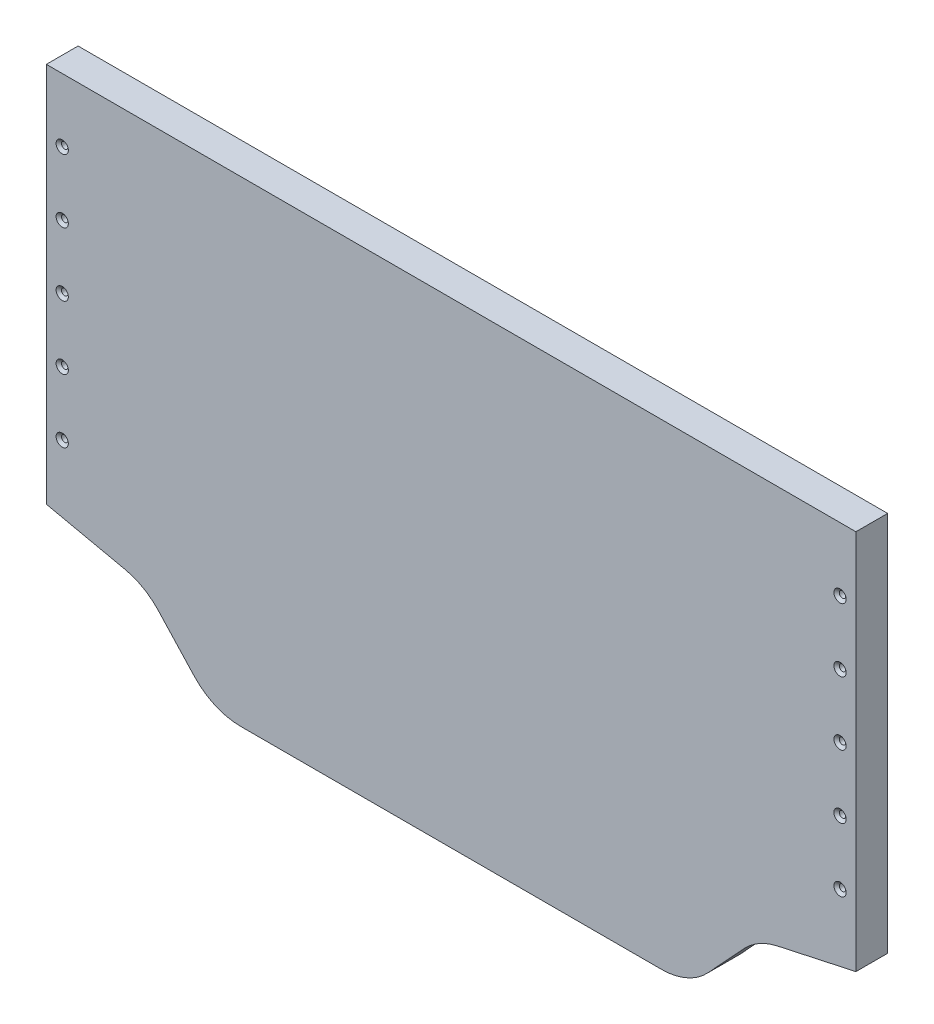
from build123d import *

# Parameters (mm, degrees)
BOSS_EXTRUDE1_DEPTH                        = 25.4
FILLET1_R                                  = 50.8
CSK_FOR_10_FLAT_HEAD_MACHINE_SCREW_2_COUNT = 2
CSK_FOR_10_FLAT_HEAD_MACHINE_SCREW_2_PITCH = 50.8
CSK_FOR_10_FLAT_HEAD_MACHINE_SCREW_3_COUNT = 2
CSK_FOR_10_FLAT_HEAD_MACHINE_SCREW_3_PITCH = 101.6
CSK_FOR_10_FLAT_HEAD_MACHINE_SCREW_4_COUNT = 2
CSK_FOR_10_FLAT_HEAD_MACHINE_SCREW_4_PITCH = 152.4
CSK_FOR_10_FLAT_HEAD_MACHINE_SCREW_5_COUNT = 2
CSK_FOR_10_FLAT_HEAD_MACHINE_SCREW_5_PITCH = 203.2


with BuildPart() as part:
    # Sketch1 → Boss-Extrude1 (new body)
    with BuildSketch(Plane.XY):
        Polygon((-245.162116144, 59.122546749), (-190.5, 0), (190.5, 0), (245.162116144, 59.122546749), (323.85, 76.2), (323.85, 381), (-323.85, 381), (-323.85, 76.2), align=None)
    extrude(amount=BOSS_EXTRUDE1_DEPTH)

    # Fillet1
    fillet1_edges = [part.edges().sort_by_distance(p)[0] for p in [
        (245.162116144, 59.122546749, 12.7),
        (190.5, 0, 12.7),
        (-190.5, 0, 12.7),
        (-245.162116144, 59.122546749, 12.7),
    ]]
    fillet(fillet1_edges, radius=FILLET1_R)

    # Sketch4 → CSK for #10 Flat Head Machine Screw (100)1 (revolve, cut)
    with BuildSketch(Plane(origin=(311.15, 330.2, 25.4), x_dir=(0, -1, 0), z_dir=(1, 0, 0))):
        Polygon((0, 0), (0, 52.333816902), (2.5527, 50.8), (2.5527, 1.960808018), (4.8895, 0), align=None)
    csk_for_10_flat_head_machine_screw_100 = revolve(axis=Axis((311.15, 330.2, 31.75), (0, 0, -1)), mode=Mode.SUBTRACT)

    # CSK for _10 Flat Head Machine Screw  2: CSK for #10 Flat Head Machine Screw (100)1 ×2
    with Locations(*[(0, -i * CSK_FOR_10_FLAT_HEAD_MACHINE_SCREW_2_PITCH, 0) for i in range(1, CSK_FOR_10_FLAT_HEAD_MACHINE_SCREW_2_COUNT)]):
        add(csk_for_10_flat_head_machine_screw_100, mode=Mode.SUBTRACT)

    # CSK for _10 Flat Head Machine Screw  3: CSK for #10 Flat Head Machine Screw (100)1 ×2
    with Locations(*[(0, -i * CSK_FOR_10_FLAT_HEAD_MACHINE_SCREW_3_PITCH, 0) for i in range(1, CSK_FOR_10_FLAT_HEAD_MACHINE_SCREW_3_COUNT)]):
        add(csk_for_10_flat_head_machine_screw_100, mode=Mode.SUBTRACT)

    # CSK for _10 Flat Head Machine Screw  4: CSK for #10 Flat Head Machine Screw (100)1 ×2
    with Locations(*[(0, -i * CSK_FOR_10_FLAT_HEAD_MACHINE_SCREW_4_PITCH, 0) for i in range(1, CSK_FOR_10_FLAT_HEAD_MACHINE_SCREW_4_COUNT)]):
        add(csk_for_10_flat_head_machine_screw_100, mode=Mode.SUBTRACT)

    # CSK for _10 Flat Head Machine Screw  5: CSK for #10 Flat Head Machine Screw (100)1 ×2
    with Locations(*[(0, -i * CSK_FOR_10_FLAT_HEAD_MACHINE_SCREW_5_PITCH, 0) for i in range(1, CSK_FOR_10_FLAT_HEAD_MACHINE_SCREW_5_COUNT)]):
        add(csk_for_10_flat_head_machine_screw_100, mode=Mode.SUBTRACT)

    # Mirror1: CSK for #10 Flat Head Machine Screw (100)1 across plane
    add(csk_for_10_flat_head_machine_screw_100.mirror(Plane(origin=(0, 0, 0), x_dir=(0, 0, 1), z_dir=(1, 0, 0))), mode=Mode.SUBTRACT)

    # Mirror1 copy 1 sketch → Mirror1 copy 1 (revolve, cut)
    with BuildSketch(Plane(origin=(-311.15, 279.4, 25.4), x_dir=(0, -1, 0), z_dir=(-1, 0, 0))):
        Polygon((0, 0), (0, -52.333816902), (2.5527, -50.8), (2.5527, -1.960808018), (4.8895, 0), align=None)
    revolve(axis=Axis((-311.15, 279.4, 31.75), (0, 0, 1)), mode=Mode.SUBTRACT)

    # Mirror1 copy 2 sketch → Mirror1 copy 2 (revolve, cut)
    with BuildSketch(Plane(origin=(-311.15, 228.6, 25.4), x_dir=(0, -1, 0), z_dir=(-1, 0, 0))):
        Polygon((0, 0), (0, -52.333816902), (2.5527, -50.8), (2.5527, -1.960808018), (4.8895, 0), align=None)
    revolve(axis=Axis((-311.15, 228.6, 31.75), (0, 0, 1)), mode=Mode.SUBTRACT)

    # Mirror1 copy 3 sketch → Mirror1 copy 3 (revolve, cut)
    with BuildSketch(Plane(origin=(-311.15, 177.8, 25.4), x_dir=(0, -1, 0), z_dir=(-1, 0, 0))):
        Polygon((0, 0), (0, -52.333816902), (2.5527, -50.8), (2.5527, -1.960808018), (4.8895, 0), align=None)
    revolve(axis=Axis((-311.15, 177.8, 31.75), (0, 0, 1)), mode=Mode.SUBTRACT)

    # Mirror1 copy 4 sketch → Mirror1 copy 4 (revolve, cut)
    with BuildSketch(Plane(origin=(-311.15, 127, 25.4), x_dir=(0, -1, 0), z_dir=(-1, 0, 0))):
        Polygon((0, 0), (0, -52.333816902), (2.5527, -50.8), (2.5527, -1.960808018), (4.8895, 0), align=None)
    revolve(axis=Axis((-311.15, 127, 31.75), (0, 0, 1)), mode=Mode.SUBTRACT)


solid = part.part
